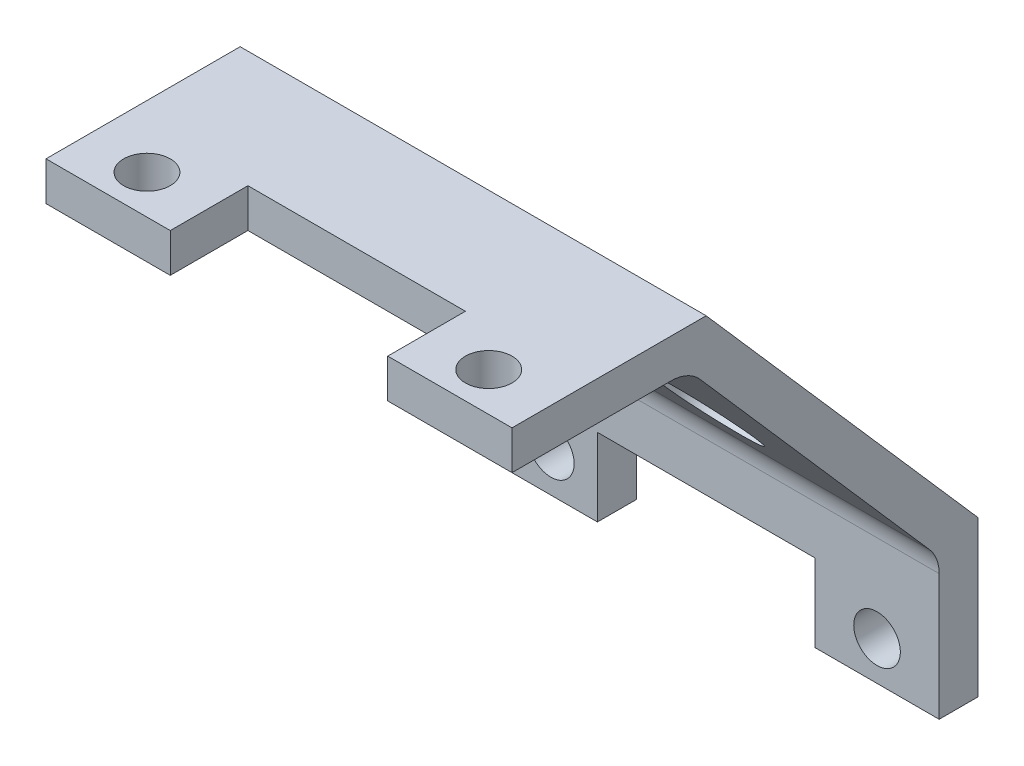
from build123d import *

# Parameters (mm, degrees)
BOSS_EXTRUDE1_DEPTH = 60
CUT_EXTRUDE1_REACH  = 104.837
SKETCH2_R           = 6
CUT_EXTRUDE2_REACH  = 105.923
SKETCH3_R           = 3
SKETCH3_W           = 28
SKETCH3_H           = 10
SKETCH4_R           = 3
SKETCH4_W           = 28
SKETCH4_H           = 10
CUT_EXTRUDE3_DEPTH  = 60


with BuildPart() as part:
    # Sketch1 → Boss-Extrude1 (new body)
    with BuildSketch(Plane(origin=(0, 0, 0), x_dir=(0, 0, -1), z_dir=(1, 0, 0))):
        with BuildLine():
            Line((-55, 60), (-55, 55))
            Line((-55, 55), (-34.537682266, 55))
            ThreePointArc((-34.537682266, 55), (-32.471600854, 54.55316457), (-30.774798792, 53.292523039))
            Line((-30.774798792, 53.292523039), (-1.237116526, 19.535171878))
            ThreePointArc((-1.237116526, 19.535171878), (-0.31948628, 18.001282205), (0, 16.242648839))
            Line((0, 16.242648839), (0, 0))
            Line((0, 0), (5, 0))
            Line((5, 0), (5, 20))
            Line((5, 20), (-30, 60))
            Line((-30, 60), (-55, 60))
        make_face()
    extrude(amount=BOSS_EXTRUDE1_DEPTH)

    # Sketch2 → Cut-Extrude1 (cut, up to next)
    with BuildSketch(Plane(origin=(0, 11.150442478, -12.743362832), x_dir=(-1, 0, 0), z_dir=(0, 0.6585046078685178, -0.752576694706878)), mode=Mode.PRIVATE) as cut_extrude1_sk1:
        with Locations(Location((-40, 48.334739918, 0), (0, 0, 90))):
            Circle(SKETCH2_R)
    cut_extrude1_tool1 = extrude(cut_extrude1_sk1.sketch, amount=-CUT_EXTRUDE1_REACH, mode=Mode.PRIVATE) & part.part
    # Sketch2 → Cut-Extrude1 (cut, up to next)
    with BuildSketch(Plane(origin=(0, 11.150442478, -12.743362832), x_dir=(-1, 0, 0), z_dir=(0, 0.6585046078685178, -0.752576694706878)), mode=Mode.PRIVATE) as cut_extrude1_sk2:
        with Locations(Location((-40, 28.334739918, 0), (0, 0, 90))):
            Circle(SKETCH2_R)
    cut_extrude1_tool2 = extrude(cut_extrude1_sk2.sketch, amount=-CUT_EXTRUDE1_REACH, mode=Mode.PRIVATE) & part.part
    # Sketch2 → Cut-Extrude1 (cut, up to next)
    with BuildSketch(Plane(origin=(0, 11.150442478, -12.743362832), x_dir=(-1, 0, 0), z_dir=(0, 0.6585046078685178, -0.752576694706878)), mode=Mode.PRIVATE) as cut_extrude1_sk3:
        with Locations(Location((-20, 48.334739918, 0), (0, 0, 90))):
            Circle(SKETCH2_R)
    cut_extrude1_tool3 = extrude(cut_extrude1_sk3.sketch, amount=-CUT_EXTRUDE1_REACH, mode=Mode.PRIVATE) & part.part
    # Sketch2 → Cut-Extrude1 (cut, up to next)
    with BuildSketch(Plane(origin=(0, 11.150442478, -12.743362832), x_dir=(-1, 0, 0), z_dir=(0, 0.6585046078685178, -0.752576694706878)), mode=Mode.PRIVATE) as cut_extrude1_sk4:
        with Locations(Location((-20, 28.334739918, 0), (0, 0, 90))):
            Circle(SKETCH2_R)
    cut_extrude1_tool4 = extrude(cut_extrude1_sk4.sketch, amount=-CUT_EXTRUDE1_REACH, mode=Mode.PRIVATE) & part.part
    add(cut_extrude1_tool1.solids().sort_by_distance((40, 47.526041, 19.085286))[0], mode=Mode.SUBTRACT)
    add(cut_extrude1_tool2.solids().sort_by_distance((40, 32.474507, 5.915194))[0], mode=Mode.SUBTRACT)
    add(cut_extrude1_tool3.solids().sort_by_distance((20, 47.526041, 19.085286))[0], mode=Mode.SUBTRACT)
    add(cut_extrude1_tool4.solids().sort_by_distance((20, 32.474507, 5.915194))[0], mode=Mode.SUBTRACT)

    # Sketch3 → Cut-Extrude2 (cut, up to next)
    with BuildSketch(Plane(origin=(0, 0, -5), x_dir=(-1, 0, 0), z_dir=(0, 0, -1)), mode=Mode.PRIVATE) as cut_extrude2_sk1:
        with Locations((-52, 5)):
            Circle(SKETCH3_R)
    cut_extrude2_tool1 = extrude(cut_extrude2_sk1.sketch, amount=-CUT_EXTRUDE2_REACH, mode=Mode.PRIVATE) & part.part
    # Sketch3 → Cut-Extrude2 (cut, up to next)
    with BuildSketch(Plane(origin=(0, 0, -5), x_dir=(-1, 0, 0), z_dir=(0, 0, -1)), mode=Mode.PRIVATE) as cut_extrude2_sk2:
        with Locations((-10, 5)):
            Circle(SKETCH3_R)
    cut_extrude2_tool2 = extrude(cut_extrude2_sk2.sketch, amount=-CUT_EXTRUDE2_REACH, mode=Mode.PRIVATE) & part.part
    # Sketch3 → Cut-Extrude2 (cut, up to next)
    with BuildSketch(Plane(origin=(0, 0, -5), x_dir=(-1, 0, 0), z_dir=(0, 0, -1)), mode=Mode.PRIVATE) as cut_extrude2_sk3:
        with Locations((-30, 5)):
            Rectangle(SKETCH3_W, SKETCH3_H)
    cut_extrude2_tool3 = extrude(cut_extrude2_sk3.sketch, amount=-CUT_EXTRUDE2_REACH, mode=Mode.PRIVATE) & part.part
    add(cut_extrude2_tool1.solids().sort_by_distance((52, 5, -5))[0], mode=Mode.SUBTRACT)
    add(cut_extrude2_tool2.solids().sort_by_distance((10, 5, -5))[0], mode=Mode.SUBTRACT)
    add(cut_extrude2_tool3.solids().sort_by_distance((30, 5, -5))[0], mode=Mode.SUBTRACT)

    # Sketch4 → Cut-Extrude3 (cut)
    with BuildSketch(Plane(origin=(0, 60, 0), x_dir=(1, 0, 0), z_dir=(0, 1, 0))):
        with Locations(Location((8, -50, 0), (0, 0, 270))):
            Circle(SKETCH4_R)
        with Locations(Location((52, -50, 0), (0, 0, 270))):
            Circle(SKETCH4_R)
        with Locations((30, -50)):
            Rectangle(SKETCH4_W, SKETCH4_H)
    extrude(amount=-CUT_EXTRUDE3_DEPTH, mode=Mode.SUBTRACT)


solid = part.part
